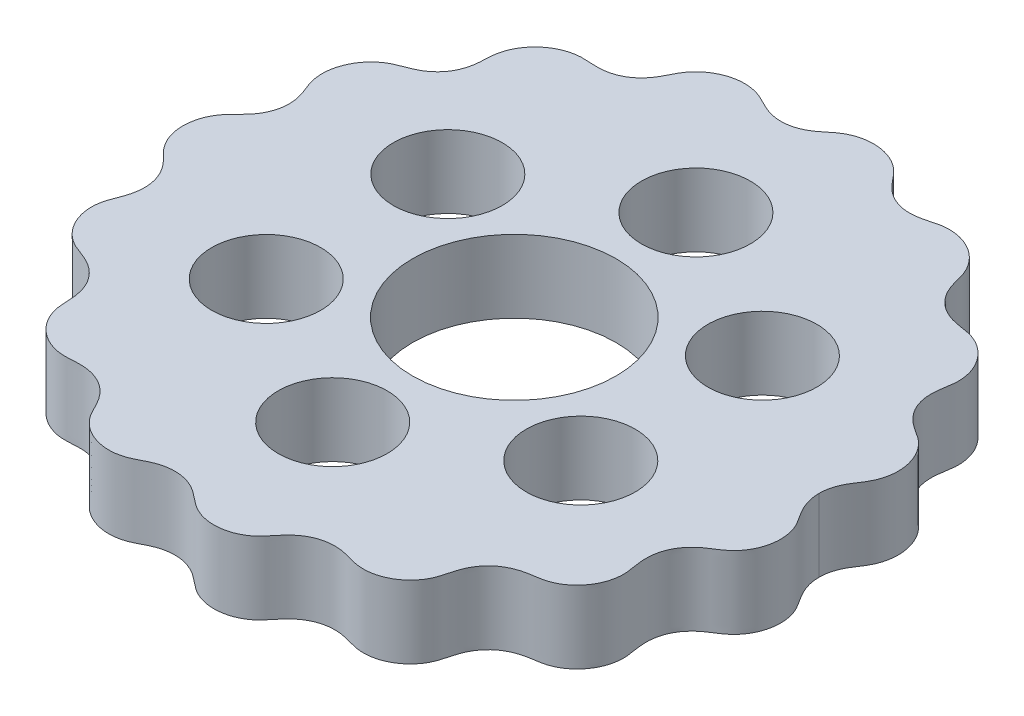
from build123d import *

# Parameters (mm, degrees)
BOSS_EXTRUDE1_DEPTH = 10
SKETCH2_R           = 14
SKETCH2_R_2         = 7.5
CUT_EXTRUDE1_DEPTH  = 10


with BuildPart() as part:
    # Sketch1 → Boss-Extrude1 (new body)
    with BuildSketch(Plane(origin=(0, 0, 0), x_dir=(1, 0, 0), z_dir=(0, 1, 0))):
        with BuildLine():
            add(Edge.make_bspline(
                [(41.9625, 1e-09), (41.9625, -0.043943873), (41.963367709, -0.109440453), (41.966260084, -0.224734633), (41.972746873, -0.36071755), (41.979628779, -0.464076704), (41.990317251, -0.589563509), (42.006468165, -0.740132558), (42.030181905, -0.917454492), (42.063888039, -1.117965428), (42.104174894, -1.317367325), (42.16245681, -1.56499836), (42.272908492, -1.95667752), (42.463462552, -2.483700229), (42.78475924, -3.15211118), (43.240069733, -3.894915583), (43.754206937, -4.631107729), (44.217683591, -5.43631391), (44.59425446, -6.416170377), (44.813828894, -7.566064191), (44.804910224, -8.8649839), (44.495722392, -10.255125061), (43.937735053, -11.462762187), (43.204306155, -12.454567878), (42.464676244, -13.13094188), (41.831827284, -13.568785947), (41.181137191, -13.977792949), (40.433944339, -14.463652215), (39.545720243, -15.1905553), (38.659749779, -16.286323315), (38.015727373, -17.682345681), (37.759204143, -19.078388465), (37.79357568, -20.375714824), (37.992107593, -21.53086764), (38.170587222, -22.570996955), (38.171232832, -23.738731157), (37.920784816, -24.989869535), (37.373699001, -26.249547163), (36.616344093, -27.289124743), (35.825134221, -28.038691113), (35.030162952, -28.595162093), (34.260745427, -28.994657539), (33.366468937, -29.30009381), (32.363131132, -29.463463415), (31.422807967, -29.58811716), (30.56063248, -29.793898137), (29.790062739, -30.072130191), (29.114590519, -30.409419343), (28.327715723, -30.928266557), (27.493656586, -31.699713744), (26.7860405, -32.696292266), (26.269170332, -33.890923871), (25.96760591, -35.040099508), (25.709695601, -36.092408745), (25.235262526, -37.181186728), (24.495453113, -38.233843144), (23.475448902, -39.175564288), (22.189309832, -39.918113505), (20.863748447, -40.330613061), (19.582230515, -40.444960305), (18.402077087, -40.311473972), (17.361851919, -40.008614506), (16.215746772, -39.695303885), (14.92290708, -39.545428787), (13.516641017, -39.678037959), (12.083375515, -40.187693493), (10.921503061, -40.960689897), (10.028593245, -41.858586236), (9.41069706, -42.657983885), (8.933554165, -43.251527228), (8.402449476, -43.797636323), (7.735204115, -44.351115071), (6.782726817, -44.905987717), (5.503890846, -45.336126395), (4.045919243, -45.49138646), (2.68147496, -45.335274627), (1.47272414, -44.926636437), (0.461765505, -44.342188236), (-0.349776814, -43.667569214), (-1.250900544, -42.918051169), (-2.357233156, -42.239625817), (-3.694503356, -41.763757654), (-5.225504507, -41.623487389), (-6.61745467, -41.842876179), (-7.691079472, -42.248648215), (-8.485448788, -42.652809187), (-9.16499251, -43.011814442), (-9.860622715, -43.340965902), (-10.816158401, -43.643299887), (-12.041858003, -43.782591962), (-13.380809629, -43.660669867), (-14.765803026, -43.220837448), (-15.936529485, -42.542105079), (-16.866429737, -41.706129414), (-17.473232553, -40.897585706), (-17.847045079, -40.223851482), (-18.18675731, -39.533706002), (-18.596406156, -38.723868191), (-19.240262657, -37.735752464), (-20.273367286, -36.710113324), (-21.655207072, -35.912307751), (-23.059988937, -35.530432468), (-24.237650509, -35.466894245), (-25.143815049, -35.517046844), (-25.911354682, -35.567920161), (-26.681731899, -35.58105613), (-27.685352698, -35.45982133), (-28.874278987, -35.072491921), (-30.047441691, -34.397979251), (-31.120844437, -33.418455996), (-31.895907882, -32.319850919), (-32.388127208, -31.188717892), (-32.604066138, -30.210032717), (-32.666827717, -29.443023564), (-32.695691903, -28.675018798), (-32.742862901, -27.784994328), (-32.928266394, -26.652321919), (-33.434245234, -25.337163377), (-34.321223388, -24.08141254), (-35.401972459, -23.161236779), (-36.542672266, -22.542337102), (-37.64233595, -22.136700437), (-38.632344068, -21.771193092), (-39.643970781, -21.187902284), (-40.602236578, -20.345410902), (-41.419656633, -19.241825982), (-42.014181502, -17.901551355), (-42.281091363, -16.578984361), (-42.27679159, -15.476667702), (-42.131094623, -14.622093298), (-41.923689562, -13.889058041), (-41.648265739, -13.179134835), (-41.264862411, -12.244198763), (-40.93379364, -11.022149063), (-40.845185542, -9.629182831), (-41.120609234, -8.133498206), (-41.708638421, -6.848721004), (-42.485300802, -5.805071484), (-43.232792198, -5.062648252), (-43.818961891, -4.501401749), (-44.26476402, -3.991371461), (-44.58678631, -3.55604387), (-44.845648259, -3.129712348), (-45.050522972, -2.723409275), (-45.20991406, -2.343572324), (-45.332474786, -1.995940011), (-45.421866074, -1.685972791), (-45.485777172, -1.417045993), (-45.530513031, -1.19111257), (-45.561198423, -1.009546849), (-45.586771757, -0.826883397), (-45.607232368, -0.64304574), (-45.620660595, -0.48571169), (-45.628973615, -0.346175955), (-45.634728892, -0.198433203), (-45.636860514, -0.098235553), (-45.6375, -0.039303978), (-45.6375, 1e-09)],
                knots=[0.072058044, 0.072058044, 0.072058044, 0.072058044, 0.072058044, 0.07321599, 0.073794963, 0.074373936, 0.074945781, 0.075517627, 0.076661318, 0.077805009, 0.0789487, 0.080092392, 0.081236083, 0.083523465, 0.08809823, 0.092672995, 0.097880803, 0.103088612, 0.10829642, 0.113504229, 0.121383195, 0.129262162, 0.137279104, 0.145296047, 0.151057366, 0.156818686, 0.159699346, 0.162580006, 0.168341325, 0.176860734, 0.185380144, 0.193962156, 0.202544169, 0.208468552, 0.214392935, 0.220317317, 0.2262417, 0.234567567, 0.242893434, 0.250927106, 0.254943942, 0.258960778, 0.26466442, 0.270368062, 0.276071704, 0.281775346, 0.286007161, 0.290238976, 0.294470791, 0.298702606, 0.307161533, 0.315620461, 0.321703787, 0.327787113, 0.333870439, 0.339953765, 0.348239221, 0.356524678, 0.364810134, 0.37309559, 0.379178916, 0.385262242, 0.391345568, 0.397428894, 0.405887822, 0.414346749, 0.42281038, 0.43127401, 0.436977651, 0.442681293, 0.445533114, 0.448384935, 0.454088577, 0.462122249, 0.470155921, 0.478481788, 0.486807655, 0.492732038, 0.498656421, 0.504580803, 0.510505186, 0.519087199, 0.527669212, 0.536188621, 0.54470803, 0.55046935, 0.553350009, 0.556230669, 0.561991989, 0.567753308, 0.575770251, 0.583787193, 0.591984249, 0.600181304, 0.605948351, 0.611715399, 0.614598922, 0.617482446, 0.623249493, 0.632120405, 0.640991316, 0.649862227, 0.658733138, 0.664500186, 0.667383709, 0.670267233, 0.67603428, 0.681801328, 0.689998383, 0.698195438, 0.706212381, 0.714229323, 0.719990643, 0.725751963, 0.728632622, 0.731513282, 0.737274602, 0.745794011, 0.75431342, 0.762895433, 0.771477446, 0.777401828, 0.783326211, 0.789250594, 0.795174977, 0.803500844, 0.811826711, 0.819860383, 0.827894055, 0.833597697, 0.836449518, 0.839301338, 0.84500498, 0.850708622, 0.859172252, 0.867635882, 0.87609481, 0.884553737, 0.890637063, 0.896720389, 0.899762052, 0.902803716, 0.905845379, 0.908887042, 0.910958406, 0.91302977, 0.915101134, 0.917172498, 0.91820818, 0.919243862, 0.920279544, 0.921315226, 0.922350908, 0.92338659, 0.923904431, 0.924422272, 0.925457954, 0.925457954, 0.925457954, 0.925457954, 0.925457954], degree=4))
            add(Edge.make_bspline(
                [(41.9625, 1e-09), (41.9625, 0.041399527), (41.963319569, 0.102520256), (41.966051474, 0.213647882), (41.972251946, 0.342898133), (41.978981383, 0.442632555), (41.98969214, 0.566486306), (42.006228418, 0.718026369), (42.030689609, 0.895484754), (42.0656621, 1.095976646), (42.107549665, 1.29558187), (42.168427199, 1.542952915), (42.283580394, 1.934253617), (42.483191693, 2.458801442), (42.817337587, 3.122968413), (43.287891626, 3.857329347), (43.79889861, 4.598382564), (44.239985062, 5.418545277), (44.595162003, 6.40791418), (44.797465154, 7.562754841), (44.77920624, 8.865288084), (44.468028435, 10.260877778), (43.916381033, 11.476170721), (43.195149299, 12.47916318), (42.37972764, 13.261536494), (41.53595972, 13.839492583), (40.718749073, 14.331105222), (40.004163221, 14.862899252), (39.267834684, 15.558646985), (38.574340946, 16.46971336), (38.011241403, 17.691496315), (37.774059834, 19.091797906), (37.834341062, 20.253839274), (37.983038182, 21.149284443), (38.093499086, 21.797810447), (38.160159286, 22.320231358), (38.197154858, 22.977659301), (38.14969249, 23.875183458), (37.905302473, 24.9905926), (37.347574403, 26.247333051), (36.479012888, 27.436353664), (35.471567007, 28.33586962), (34.415755466, 28.957913373), (33.373185929, 29.341043626), (32.396423496, 29.531486114), (31.467393339, 29.64451055), (30.604122286, 29.825895231), (29.820825654, 30.086210598), (29.125782272, 30.41714466), (28.324024474, 30.934415308), (27.486165662, 31.712213021), (26.867973347, 32.608280456), (26.458350084, 33.544327948), (26.22573326, 34.284045747), (26.089122378, 34.798867731), (25.959180736, 35.315140323), (25.811217386, 35.826952333), (25.583354222, 36.452993741), (25.180536013, 37.269478711), (24.504082846, 38.209507564), (23.468984114, 39.157636943), (22.158283029, 39.914465633), (20.819644557, 40.336599535), (19.667209322, 40.452758647), (18.75895026, 40.392837588), (17.971085215, 40.255071559), (17.200724459, 40.042744386), (16.200224767, 39.752042958), (14.920978324, 39.57287714), (13.508323203, 39.685892672), (12.243632859, 40.138303131), (11.270148788, 40.751921596), (10.50908436, 41.427670899), (9.920511603, 42.084674827), (9.358021552, 42.832675831), (8.704761381, 43.583382123), (7.851652183, 44.294695851), (6.785054871, 44.898041192), (5.502319301, 45.32075213), (4.038322341, 45.4784413), (2.671085194, 45.333075634), (1.58292014, 44.987020416), (0.781908664, 44.579361126), (0.231058142, 44.218608552), (-0.188042214, 43.899668373), (-0.69445128, 43.479743548), (-1.395581442, 42.903245465), (-2.371797625, 42.27001964), (-3.703085869, 41.775274251), (-5.042729782, 41.652041056), (-6.178484541, 41.797091398), (-7.149182028, 42.086896202), (-7.967026496, 42.439849915), (-8.801372188, 42.90176635), (-9.723794006, 43.343516467), (-10.809040666, 43.658500225), (-12.038304185, 43.781617783), (-13.383661679, 43.650023751), (-14.779731493, 43.206733827), (-15.96721942, 42.527519457), (-16.821269139, 41.7780825), (-17.389757135, 41.087525195), (-17.748730694, 40.539263674), (-18.003517734, 40.081200397), (-18.295463184, 39.495113003), (-18.696136021, 38.685654291), (-19.318110865, 37.709236687), (-20.318413796, 36.706542424), (-21.648341326, 35.938708406), (-23.016851495, 35.573767788), (-24.173441367, 35.523330575), (-25.074789594, 35.581067075), (-25.72832889, 35.621278597), (-26.252416845, 35.629658185), (-26.906712029, 35.592908725), (-27.788996196, 35.445862331), (-28.8650525, 35.080952057), (-30.047013361, 34.39216453), (-31.128948604, 33.404777568), (-31.915591126, 32.305460817), (-32.423599952, 31.179328602), (-32.693439346, 30.081985546), (-32.772083431, 29.062269761), (-32.789224912, 28.108746977), (-32.892480261, 27.223996038), (-33.126850686, 26.238444949), (-33.569110778, 25.18232731), (-34.345655823, 24.083778236), (-35.439762003, 23.178221509), (-36.476259772, 22.64940638), (-37.326086795, 22.330458935), (-37.942956972, 22.10185815), (-38.428717301, 21.898376838), (-39.016563692, 21.601702333), (-39.770112348, 21.11183609), (-40.613888124, 20.342484452), (-41.423396084, 19.231106197), (-42.018833179, 17.88440155), (-42.294120345, 16.562166794), (-42.304910097, 15.33679012), (-42.115443046, 14.242325153), (-41.791954511, 13.301219534), (-41.425388756, 12.440111975), (-41.150729145, 11.601854766), (-40.945987304, 10.60493265), (-40.90876061, 9.643968493), (-41.039644958, 8.694828961), (-41.332209889, 7.790869834), (-41.653861778, 7.109124808), (-42.09944733, 6.406836478), (-42.680678199, 5.705079427), (-43.297176434, 5.114294066), (-43.866312005, 4.553483744), (-44.293727436, 4.041803063), (-44.60228141, 3.607436823), (-44.852403209, 3.181409337), (-45.052593084, 2.773748911), (-45.210057943, 2.389776348), (-45.332562889, 2.034789113), (-45.421903761, 1.718460959), (-45.485801959, 1.444205058), (-45.530523405, 1.213824508), (-45.5612053, 1.028628416), (-45.58677461, 0.8428618), (-45.60723363, 0.655222376), (-45.62066111, 0.493445818), (-45.62897382, 0.353903973), (-45.633769753, 0.229885301), (-45.636327628, 0.128497944), (-45.637286842, 0.060211726), (-45.6375, 0.019972295), (-45.6375, 1e-09)],
                knots=[0.073379942, 0.073379942, 0.073379942, 0.073379942, 0.073379942, 0.074471538, 0.075017335, 0.075563133, 0.076134945, 0.076706758, 0.077850382, 0.078994007, 0.080137631, 0.081281256, 0.082424881, 0.08471213, 0.089286628, 0.093861126, 0.099069298, 0.104277469, 0.109485641, 0.114693812, 0.122572784, 0.130451757, 0.138511613, 0.146571469, 0.152296032, 0.158020594, 0.163745157, 0.169469719, 0.173712688, 0.177955657, 0.186441594, 0.195001278, 0.203560962, 0.20946737, 0.212420574, 0.215373778, 0.218326982, 0.221280186, 0.227186594, 0.235488461, 0.243790327, 0.251894239, 0.259998151, 0.26556746, 0.271136768, 0.276706077, 0.282275385, 0.286582441, 0.290889497, 0.295196553, 0.299503609, 0.307939116, 0.316374624, 0.319362447, 0.322350271, 0.325338094, 0.328325918, 0.331313742, 0.334301565, 0.340277212, 0.348703072, 0.357128932, 0.365554792, 0.373980652, 0.379956299, 0.382944123, 0.385931946, 0.391907594, 0.397883241, 0.406318748, 0.414754256, 0.423368367, 0.427675423, 0.431982479, 0.437551788, 0.443121096, 0.448690405, 0.454259714, 0.462363625, 0.470467537, 0.478769404, 0.48707127, 0.492977678, 0.495930882, 0.498884086, 0.50183729, 0.504790494, 0.510696902, 0.519256586, 0.527816271, 0.536302208, 0.540545176, 0.544788145, 0.550512708, 0.55623727, 0.561961833, 0.567686395, 0.575746252, 0.583806108, 0.59206794, 0.600329772, 0.606207918, 0.609146991, 0.612086064, 0.615025138, 0.617964211, 0.623842357, 0.632360151, 0.640877945, 0.649395738, 0.657913532, 0.663791678, 0.666730752, 0.669669825, 0.672608898, 0.675547971, 0.681426118, 0.68968795, 0.697949782, 0.706009638, 0.714069494, 0.719794057, 0.725518619, 0.731243182, 0.736967744, 0.741210713, 0.745453681, 0.753939619, 0.762499303, 0.771058987, 0.776965395, 0.779918599, 0.782871803, 0.785825007, 0.788778211, 0.794684619, 0.802986486, 0.811288352, 0.819392264, 0.827496176, 0.833065484, 0.838634793, 0.844204102, 0.84977341, 0.854080466, 0.858387522, 0.867001634, 0.871219387, 0.875437141, 0.879654895, 0.883872649, 0.889848296, 0.895823943, 0.898811766, 0.90179959, 0.904787413, 0.907775237, 0.909881702, 0.911988167, 0.914094632, 0.916201097, 0.917254329, 0.918307562, 0.919360794, 0.920414027, 0.92146726, 0.922520492, 0.923047108, 0.923573725, 0.924100341, 0.924626957, 0.924626957, 0.924626957, 0.924626957, 0.924626957], degree=4))
        make_face()
    extrude(amount=BOSS_EXTRUDE1_DEPTH)

    # Sketch2 → Cut-Extrude1 (cut)
    with BuildSketch(Plane(origin=(0, 10, 0), x_dir=(1, 0, 0), z_dir=(0, 1, 0))):
        with Locations(Location((0, 0, 0), (0, 0, 270))):
            Circle(SKETCH2_R)
        with Locations(Location((0, 25, 0), (0, 0, 270))):
            Circle(SKETCH2_R_2)
        with Locations(Location((21.650635095, 12.5, 0), (0, 0, 270))):
            Circle(SKETCH2_R_2)
        with Locations(Location((21.650635095, -12.5, 0), (0, 0, 270))):
            Circle(SKETCH2_R_2)
        with Locations(Location((0, -25, 0), (0, 0, 270))):
            Circle(SKETCH2_R_2)
        with Locations(Location((-21.650635095, -12.5, 0), (0, 0, 270))):
            Circle(SKETCH2_R_2)
        with Locations(Location((-21.650635095, 12.5, 0), (0, 0, 270))):
            Circle(SKETCH2_R_2)
    extrude(amount=-CUT_EXTRUDE1_DEPTH, mode=Mode.SUBTRACT)


solid = part.part
